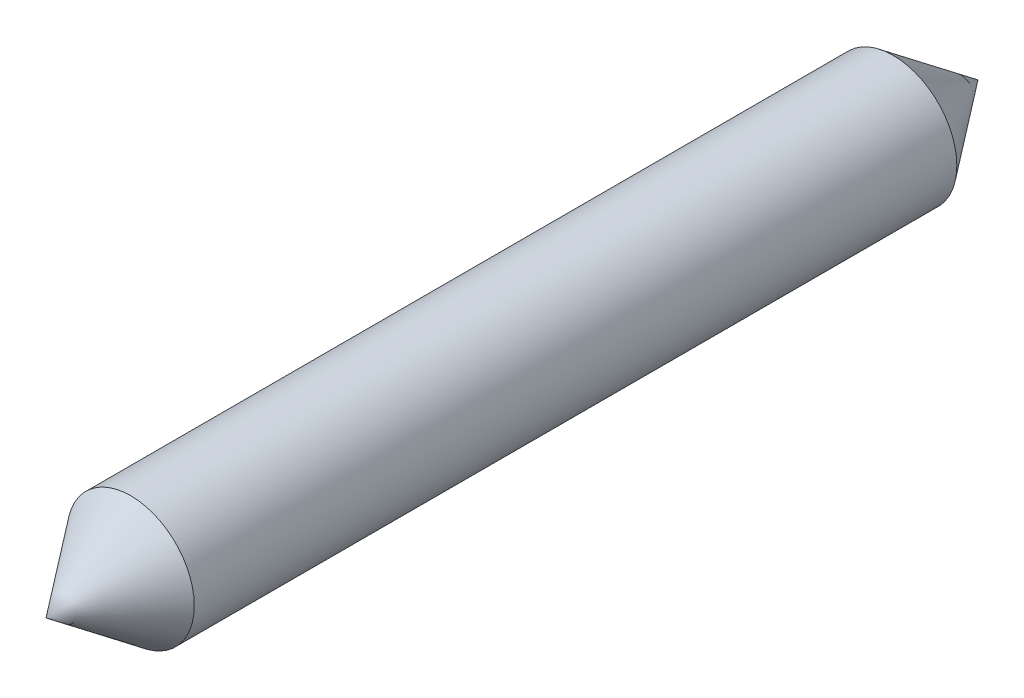
from build123d import *


with BuildPart() as part:
    # 草图1 → 旋转1 (revolve)
    with BuildSketch(Plane(origin=(0, 0, 0), x_dir=(1, 0, 0), z_dir=(0, 1, 0))):
        Polygon((0, -5.5), (0.75, -4.5), (0.75, 4.5), (0, 5.5), align=None)
    revolve(axis=Axis((0, 0, 52.158011527), (0, 0, -1)))


solid = part.part
